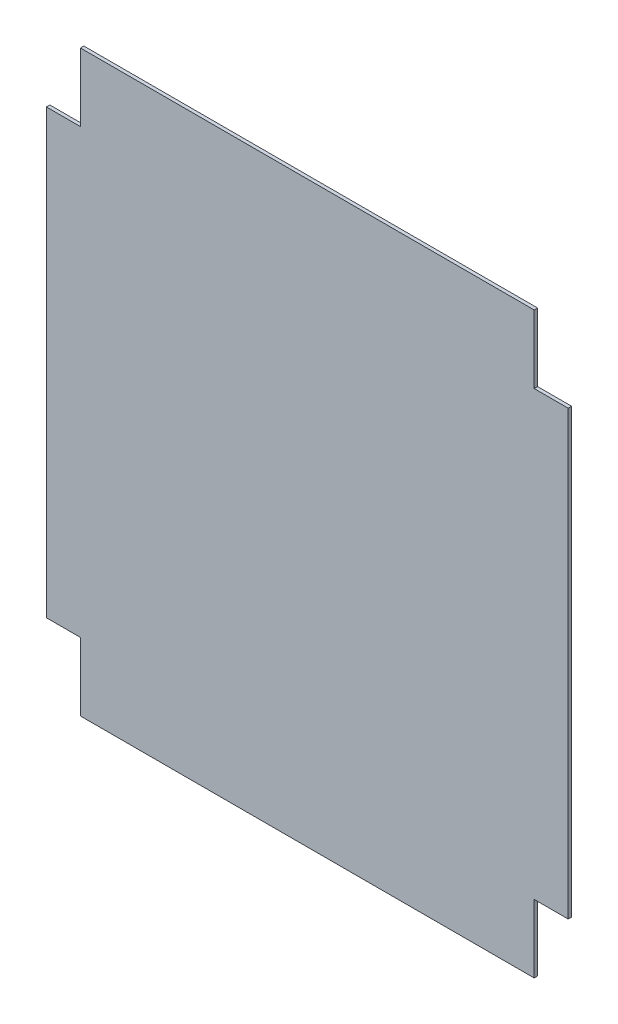
from build123d import *

# Parameters (mm, degrees)
P_IDAT_VYSUNUT_M1_DEPTH = 3


with BuildPart() as part:
    # Skica1 → Přidat vysunutím1 (new body)
    with BuildSketch(Plane.XY):
        Polygon((30, 51.21634832), (30, 111.21634832), (0, 111.21634832), (0, 501.21634832), (30, 501.21634832), (30, 561.21634832), (430, 561.21634832), (430, 501.21634832), (460, 501.21634832), (460, 111.21634832), (430, 111.21634832), (430, 51.21634832), align=None)
    extrude(amount=P_IDAT_VYSUNUT_M1_DEPTH)


solid = part.part
